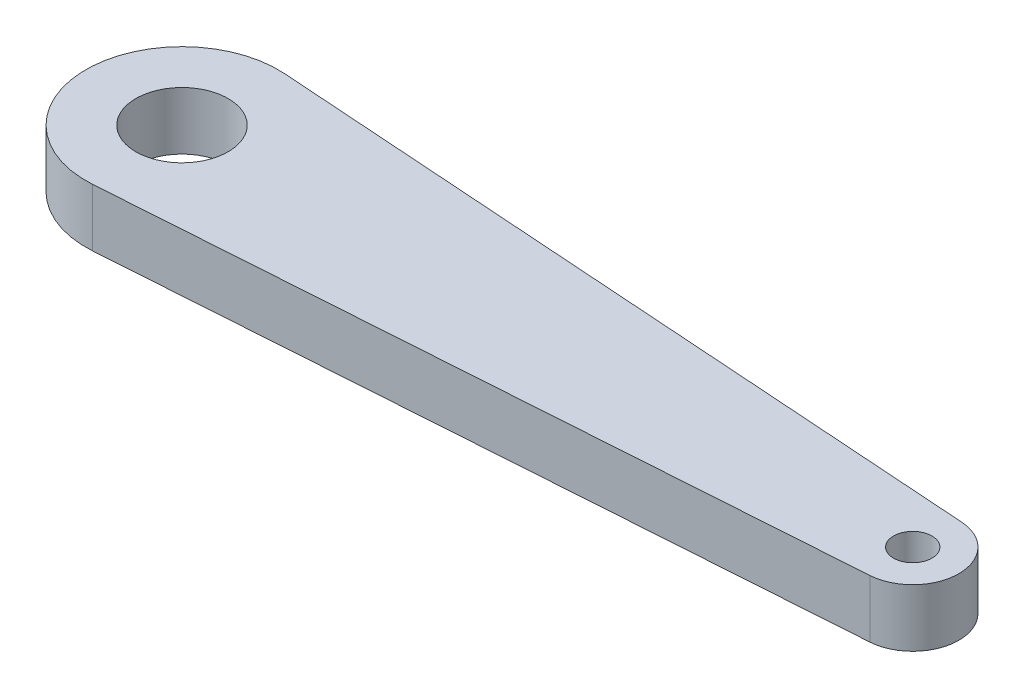
from build123d import *

# Parameters (mm, degrees)
SKETCH2_R           = 2.5
SKETCH2_R_2         = 6
BOSS_EXTRUDE1_DEPTH = 7.5


with BuildPart() as part:
    # Sketch2 → Boss-Extrude1 (new body)
    with BuildSketch(Plane(origin=(0, 0, 0), x_dir=(1, 0, 0), z_dir=(0, 1, 0))):
        with BuildLine():
            Line((-23.055314395, 12.470706673), (71.499948763, 5.985939203))
            ThreePointArc((71.499948763, 5.985939203), (77.089422447, 0), (71.499948763, -5.985939203))
            Line((71.499948763, -5.985939203), (-23.055314395, -12.470706673))
            ThreePointArc((-23.055314395, -12.470706673), (-36.410577553, 0), (-23.055314395, 12.470706673))
        make_face()
        with Locations(Location((71.089422447, 0, 0), (0, 0, 270))):
            Circle(SKETCH2_R, mode=Mode.SUBTRACT)
        with Locations(Location((-23.910577553, 0, 0), (0, 0, 270))):
            Circle(SKETCH2_R_2, mode=Mode.SUBTRACT)
    extrude(amount=BOSS_EXTRUDE1_DEPTH)


solid = part.part
